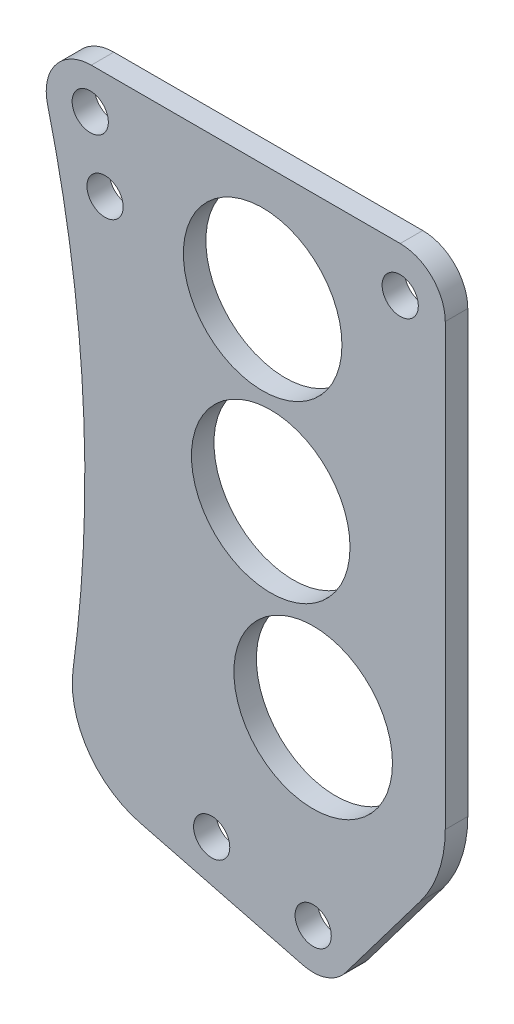
from build123d import *

# Parameters (mm, degrees)
SKETCH2_R           = 2.5527
SKETCH2_R_2         = 11.176
BOSS_EXTRUDE1_DEPTH = 3.175


with BuildPart() as part:
    # Sketch2 → Boss-Extrude1 (new body)
    with BuildSketch(Plane.XY):
        with BuildLine():
            Line((89.804840449, 162.158224077), (133.35, 162.158224077))
            ThreePointArc((133.35, 162.158224077), (137.840128061, 160.298352138), (139.7, 155.808224077))
            Line((139.7, 155.808224077), (139.7, 93.800599977))
            ThreePointArc((139.7, 93.800599977), (138.794482451, 88.24423856), (136.171639749, 83.262892317))
            Line((136.171639749, 83.262892317), (125.655155155, 69.319391612))
            ThreePointArc((125.655155155, 69.319391612), (122.975635879, 67.362639494), (119.660773298, 67.219851313))
            Line((119.660773298, 67.219851313), (96.672878026, 73.109258508))
            ThreePointArc((96.672878026, 73.109258508), (89.283742308, 78.328372298), (87.243120334, 87.141676865))
            ThreePointArc((87.243120334, 87.141676865), (88.644839635, 120.88029943), (83.642604572, 154.275465457))
            ThreePointArc((83.642604572, 154.275465457), (84.802065357, 159.719073266), (89.804840449, 162.158224077))
        make_face()
        with Locations((89.657841737, 156.395094021)):
            Circle(SKETCH2_R, mode=Mode.SUBTRACT)
        with Locations((91.747700228, 147.102187237)):
            Circle(SKETCH2_R, mode=Mode.SUBTRACT)
        with Locations((106.775437357, 76.433708644)):
            Circle(SKETCH2_R, mode=Mode.SUBTRACT)
        with Locations((115.1001, 121.545060726)):
            Circle(SKETCH2_R_2, mode=Mode.SUBTRACT)
        with Locations((113.962375762, 145.648224077)):
            Circle(SKETCH2_R_2, mode=Mode.SUBTRACT)
        with Locations((133.35, 155.808224077)):
            Circle(SKETCH2_R, mode=Mode.SUBTRACT)
        with Locations((121.082277384, 72.768353221)):
            Circle(SKETCH2_R, mode=Mode.SUBTRACT)
        with Locations((121.082277384, 98.168353221)):
            Circle(SKETCH2_R_2, mode=Mode.SUBTRACT)
    extrude(amount=BOSS_EXTRUDE1_DEPTH)


solid = part.part
